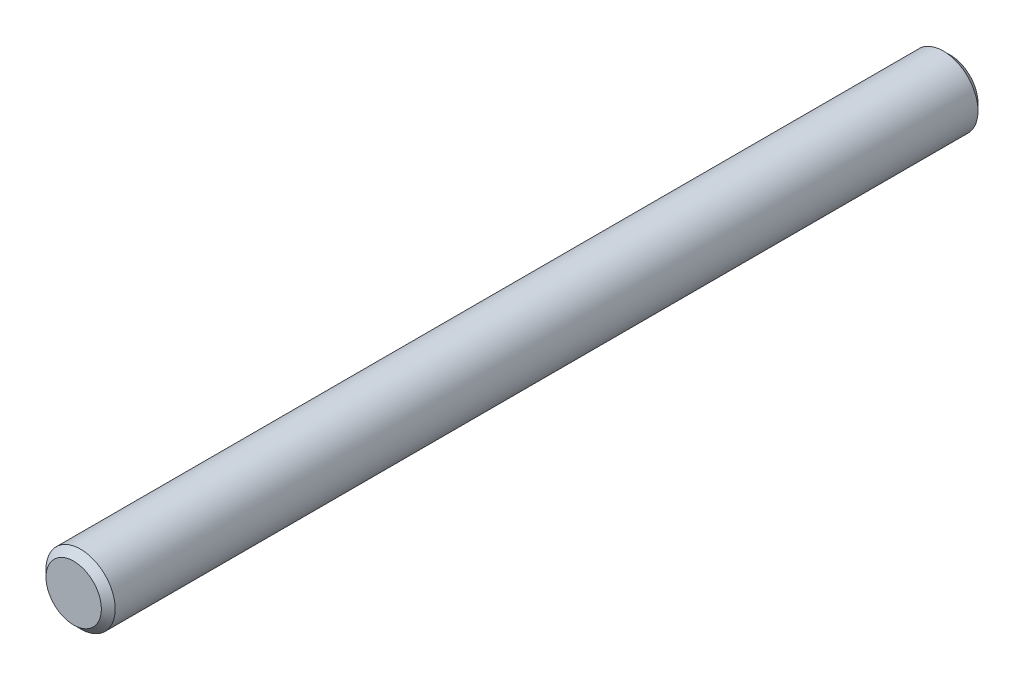
from build123d import *

# Parameters (mm, degrees)
SKETCH3_R           = 4.7625
BOSS_EXTRUDE1_DEPTH = 60.325
CHAMFER1_SIZE       = 0.9525


with BuildPart() as part:
    # Sketch3 → Boss-Extrude1 (new, symmetric)
    with BuildSketch(Plane.XY):
        with Locations(Location((0, 0, 0), (0, 0, 180))):
            Circle(SKETCH3_R)
    extrude(amount=BOSS_EXTRUDE1_DEPTH, both=True)

    # Chamfer1
    chamfer1_edges = [part.edges().sort_by_distance(p)[0] for p in [
        (4.7625, 0, -60.325),
        (4.7625, 0, 60.325),
    ]]
    chamfer(chamfer1_edges, length=CHAMFER1_SIZE)


solid = part.part
